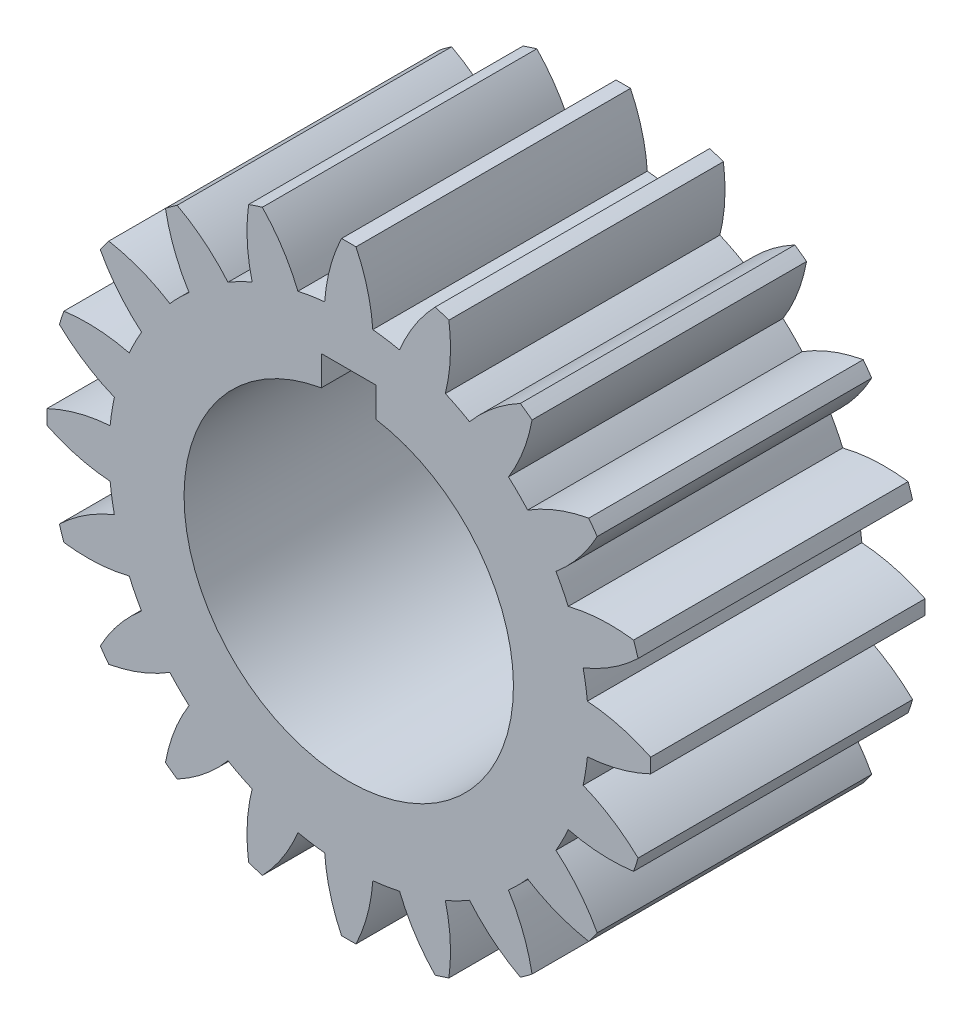
from build123d import *

# Parameters (mm, degrees)
SKETCH1_W           = 8.21
SKETCH1_H           = 30
BOSS_EXTRUDE1_DEPTH = 30
CIRPATTERN1_COUNT   = 20
SKETCH3_W           = 6
SKETCH3_H           = 6
CUT_EXTRUDE1_DEPTH  = 56.479726027


with BuildPart() as part:
    # Sketch1 → Revolve1 (revolve)
    with BuildSketch(Plane(origin=(0, 0, 0), x_dir=(1, 0, 0), z_dir=(0, 1, 0))):
        with Locations((22.105, 15)):
            Rectangle(SKETCH1_W, SKETCH1_H)
    revolve(axis=Axis((0, 0, 0), (0, 0, -1)))

    # Sketch2 → Boss-Extrude1 (add)
    with BuildSketch(Plane.XY):
        with BuildLine():
            ThreePointArc((2.63, 26.077714624), (2.037608033, 29.62132863), (0.79, 32.990542584))
            ThreePointArc((0.79, 32.990542584), (0, 33), (-0.79, 32.990542584))
            ThreePointArc((-0.79, 32.990542584), (-2.037608033, 29.62132863), (-2.63, 26.077714624))
            ThreePointArc((-2.63, 26.077714624), (0, 26.21), (2.63, 26.077714624))
        make_face()
    boss_extrude1 = extrude(amount=-BOSS_EXTRUDE1_DEPTH)

    # CirPattern1: Boss-Extrude1 ×20 about axis
    cirpattern1_axis = Axis((0, 0, 0), (0, 0, 1))
    for i in range(1, CIRPATTERN1_COUNT):
        add(boss_extrude1.rotate(cirpattern1_axis, i * 360 / CIRPATTERN1_COUNT))

    # Sketch3 → Cut-Extrude1 (cut, through all)
    with BuildSketch(Plane.XY):
        with Locations((0, 18)):
            Rectangle(SKETCH3_W, SKETCH3_H)
    extrude(amount=-CUT_EXTRUDE1_DEPTH, mode=Mode.SUBTRACT)


solid = part.part
